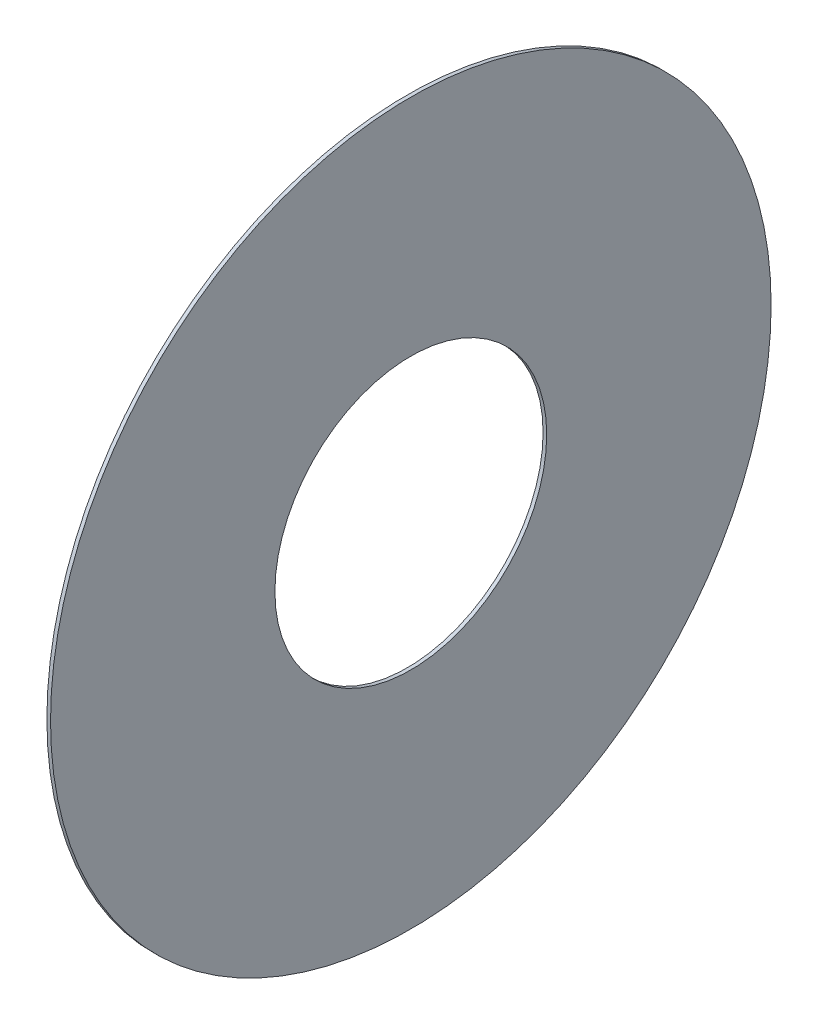
from build123d import *

# Parameters (mm, degrees)
SKETCH1_R           = 60.17006
SKETCH1_R_2         = 22.69744
BOSS_EXTRUDE1_DEPTH = 0.60706


with BuildPart() as part:
    # Sketch1 → Boss-Extrude1 (new body)
    with BuildSketch(Plane(origin=(0, 0, 0), x_dir=(0, 0, -1), z_dir=(1, 0, 0))):
        with Locations(Location((0, 0, 0), (0, 0, 180))):
            Circle(SKETCH1_R)
        with Locations(Location((0, 0, 0), (0, 0, 180))):
            Circle(SKETCH1_R_2, mode=Mode.SUBTRACT)
    extrude(amount=BOSS_EXTRUDE1_DEPTH)


solid = part.part
